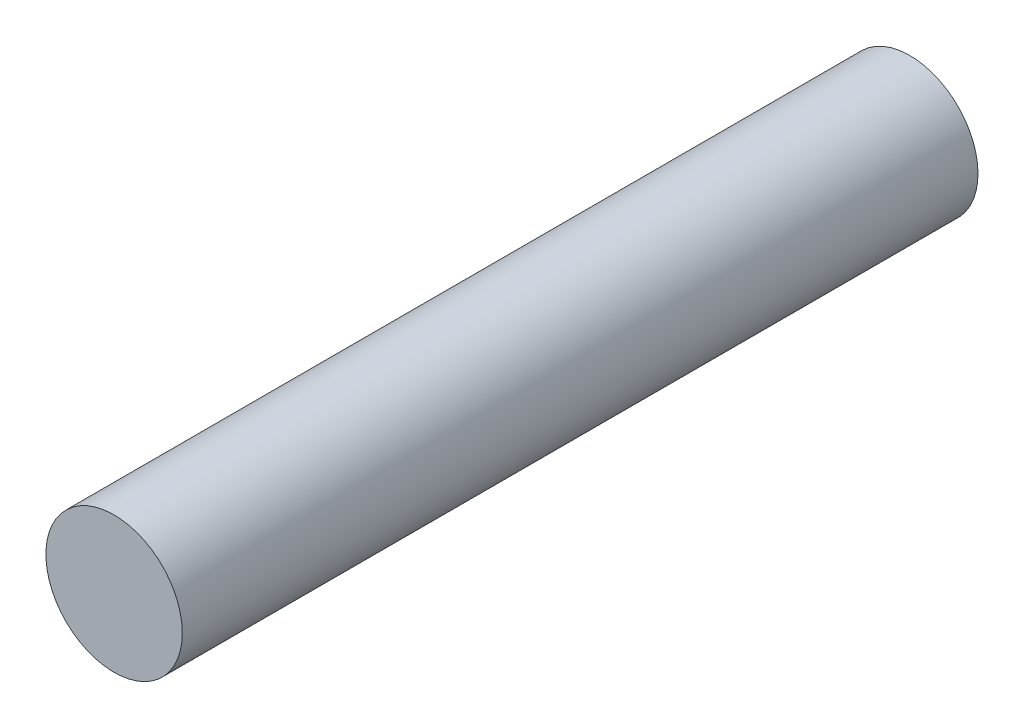
from build123d import *

# Parameters (mm, degrees)
SKETCH1_R           = 3
BOSS_EXTRUDE1_DEPTH = 17.5


with BuildPart() as part:
    # Sketch1 → Boss-Extrude1 (new, symmetric)
    with BuildSketch(Plane.XY):
        Circle(SKETCH1_R)
    extrude(amount=BOSS_EXTRUDE1_DEPTH, both=True)


solid = part.part
